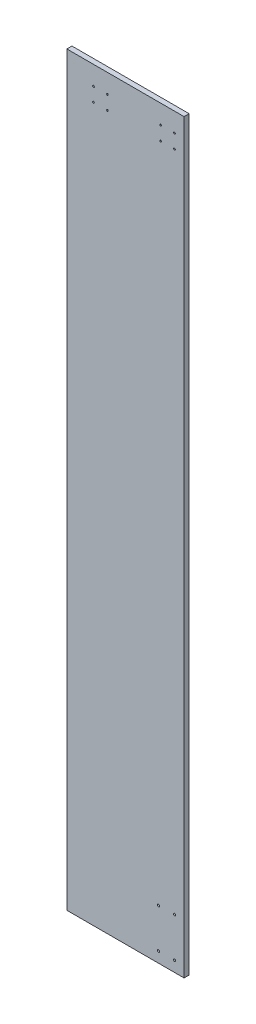
from build123d import *

# Parameters (mm, degrees)
SKETCH1_W           = 220
SKETCH1_H           = 1400
SKETCH1_R           = 2.065
SKETCH1_R_2         = 1.621
BOSS_EXTRUDE1_DEPTH = 9.525


with BuildPart() as part:
    # Sketch1 → Boss-Extrude1 (new body)
    with BuildSketch(Plane(origin=(0, 0, 0), x_dir=(-1, 0, 0), z_dir=(0, 0, 1))):
        with Locations((-110, -700)):
            Rectangle(SKETCH1_W, SKETCH1_H)
        with Locations((-202, -20)):
            Circle(SKETCH1_R, mode=Mode.SUBTRACT)
        with Locations((-172, -20)):
            Circle(SKETCH1_R, mode=Mode.SUBTRACT)
        with Locations((-202, -94)):
            Circle(SKETCH1_R, mode=Mode.SUBTRACT)
        with Locations((-172, -94)):
            Circle(SKETCH1_R, mode=Mode.SUBTRACT)
        with Locations((-202, -1338.199992786)):
            Circle(SKETCH1_R_2, mode=Mode.SUBTRACT)
        with Locations((-176, -1338.199992786)):
            Circle(SKETCH1_R_2, mode=Mode.SUBTRACT)
        with Locations((-176, -1364.199992786)):
            Circle(SKETCH1_R_2, mode=Mode.SUBTRACT)
        with Locations((-202, -1364.199992786)):
            Circle(SKETCH1_R_2, mode=Mode.SUBTRACT)
        with Locations((-76, -1338.199992786)):
            Circle(SKETCH1_R_2, mode=Mode.SUBTRACT)
        with Locations((-50, -1338.199992786)):
            Circle(SKETCH1_R_2, mode=Mode.SUBTRACT)
        with Locations((-50, -1364.199992786)):
            Circle(SKETCH1_R_2, mode=Mode.SUBTRACT)
        with Locations((-76, -1364.199992786)):
            Circle(SKETCH1_R_2, mode=Mode.SUBTRACT)
    extrude(amount=BOSS_EXTRUDE1_DEPTH)


solid = part.part
